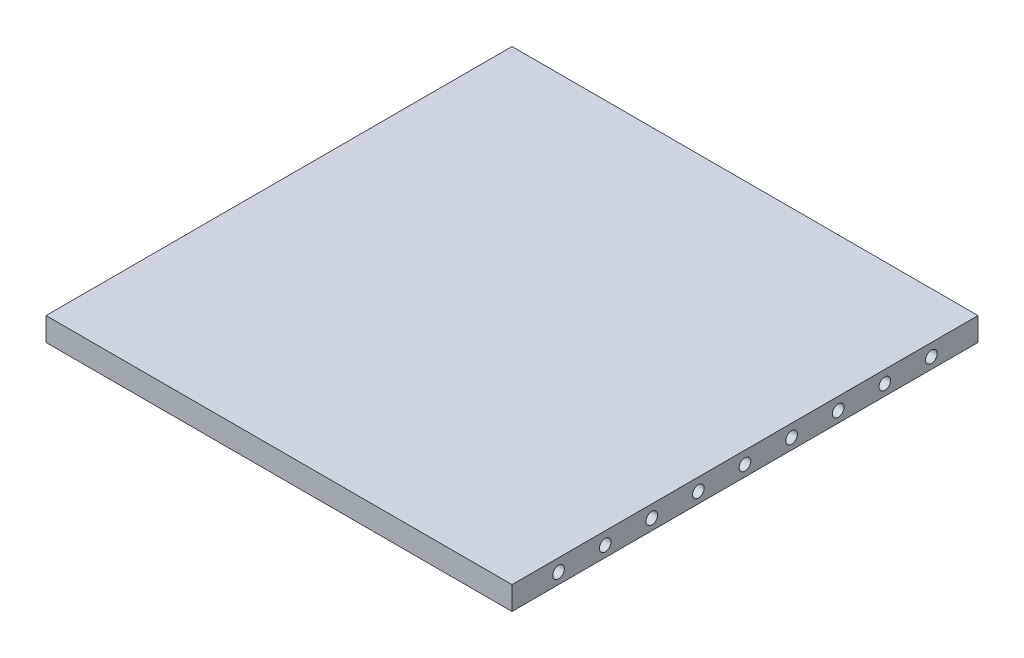
from build123d import *

# Parameters (mm, degrees)
SKETCH1_W           = 127
SKETCH1_H           = 127
BOSS_EXTRUDE1_DEPTH = 6.35
CUT_EXTRUDE1_REACH  = 144.132
SKETCH3_R           = 1.5875
LPATTERN1_COUNT     = 9
LPATTERN1_PITCH     = 12.7


with BuildPart() as part:
    # Sketch1 → Boss-Extrude1 (new body)
    with BuildSketch(Plane(origin=(0, 0, 0), x_dir=(1, 0, 0), z_dir=(0, 1, 0))):
        Rectangle(SKETCH1_W, SKETCH1_H)
    extrude(amount=BOSS_EXTRUDE1_DEPTH)

    # Sketch3 → Cut-Extrude1 (cut, up to next)
    with BuildSketch(Plane.ZY.offset(63.5), mode=Mode.PRIVATE) as cut_extrude1_sk1:
        with Locations((-50.8, 2.973801717)):
            Circle(SKETCH3_R)
    cut_extrude1_tool1 = extrude(cut_extrude1_sk1.sketch, amount=-CUT_EXTRUDE1_REACH, mode=Mode.PRIVATE) & part.part
    cut_extrude1 = cut_extrude1_tool1.solids().sort_by_distance((-63.5, 2.973802, -50.8))[0]
    add(cut_extrude1, mode=Mode.SUBTRACT)

    # LPattern1: Cut-Extrude1 ×9
    with Locations(*[(0, 0, i * LPATTERN1_PITCH) for i in range(1, LPATTERN1_COUNT)]):
        add(cut_extrude1, mode=Mode.SUBTRACT)


solid = part.part
